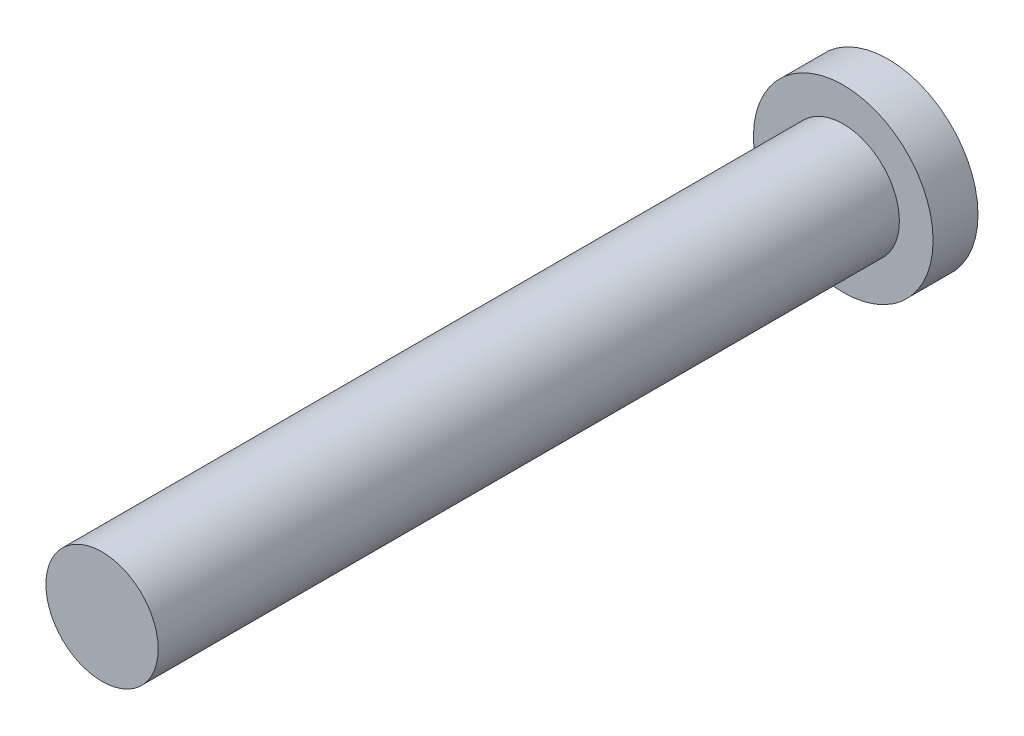
from build123d import *

# Parameters (mm, degrees)
ESQUISSE1_R        = 4
ESQUISSE1_R_2      = 2.5
BOSS_EXTRU_1_DEPTH = 2
ESQUISSE1_2_R      = 2.5
BOSS_EXTRU_2_DEPTH = 35


with BuildPart() as part:
    # Esquisse1 → Boss.-Extru.1 (new body)
    with BuildSketch(Plane.XY):
        Circle(ESQUISSE1_R)
        Circle(ESQUISSE1_R_2, mode=Mode.SUBTRACT)
    extrude(amount=BOSS_EXTRU_1_DEPTH)

    # Esquisse1<2> → Boss.-Extru.2 (add)
    with BuildSketch(Plane.XY):
        Circle(ESQUISSE1_2_R)
    extrude(amount=BOSS_EXTRU_2_DEPTH)


solid = part.part
